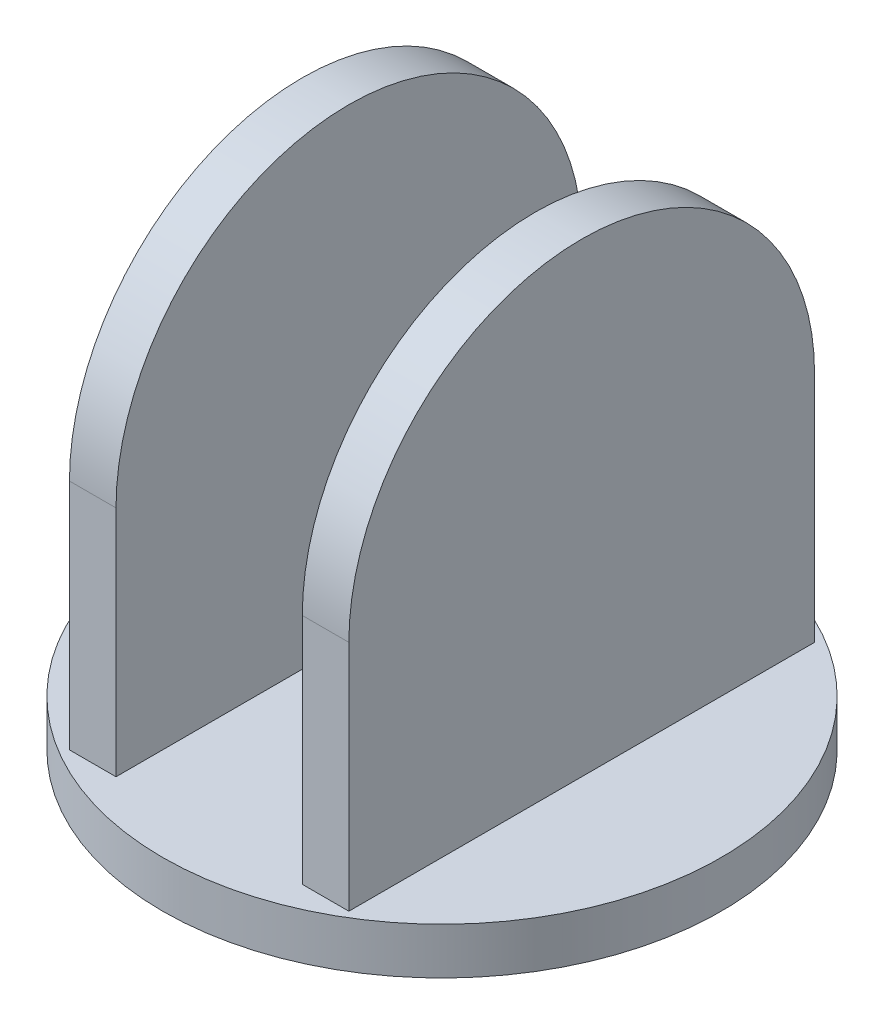
from build123d import *

# Parameters (mm, degrees)
SKETCH1_R           = 60
BOSS_EXTRUDE1_DEPTH = 10
BOSS_EXTRUDE2_START = 20
BOSS_EXTRUDE2_DEPTH = 10


with BuildPart() as part:
    # Sketch1 → Boss-Extrude1 (new body)
    with BuildSketch(Plane(origin=(0, 0, 0), x_dir=(1, 0, 0), z_dir=(0, 1, 0))):
        with Locations(Location((0, 0, 0), (0, 0, 270))):
            Circle(SKETCH1_R)
    extrude(amount=-BOSS_EXTRUDE1_DEPTH)

    # Sketch2 → Boss-Extrude2 (add)
    with BuildSketch(Plane(origin=(0, 0, 0), x_dir=(0, 0, -1), z_dir=(1, 0, 0)).offset(BOSS_EXTRUDE2_START)):
        with BuildLine():
            Line((0, 0), (50, 0))
            Line((50, 0), (50, 50))
            ThreePointArc((50, 50), (0, 100), (-50, 50))
            Line((-50, 50), (-50, 0))
            Line((-50, 0), (0, 0))
        make_face()
    boss_extrude2 = extrude(amount=BOSS_EXTRUDE2_DEPTH)

    # Mirror1: Boss-Extrude2 across plane
    add(boss_extrude2.mirror(Plane(origin=(0, 0, 0), x_dir=(0, 0, 1), z_dir=(1, 0, 0))))


solid = part.part
